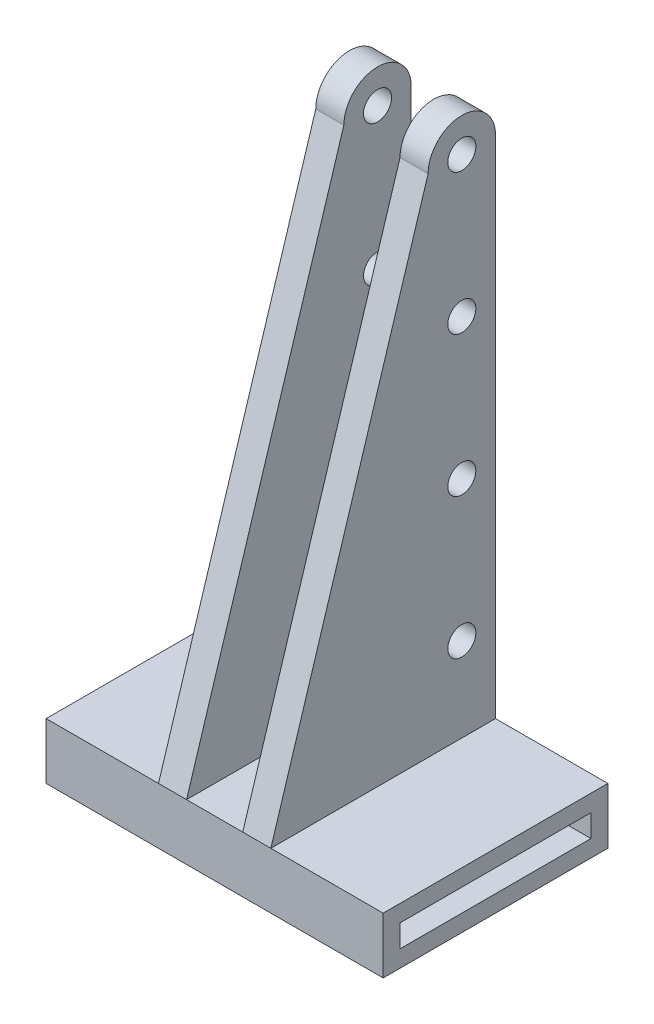
from build123d import *

# Parameters (mm, degrees)
SKETCH1_W           = 60
SKETCH1_H           = 40
BOSS_EXTRUDE1_DEPTH = 10
BOSS_EXTRUDE2_START = 5
SKETCH2_R           = 2.5
BOSS_EXTRUDE2_DEPTH = 5
BOSS_EXTRUDE3_START = -10
SKETCH2_3_R         = 2.5
BOSS_EXTRUDE3_DEPTH = 5
SKETCH3_W           = 34
SKETCH3_H           = 4
CUT_EXTRUDE1_DEPTH  = 124.434192994


with BuildPart() as part:
    # Sketch1 → Boss-Extrude1 (new body)
    with BuildSketch(Plane(origin=(0, 0, 0), x_dir=(1, 0, 0), z_dir=(0, 1, 0))):
        Rectangle(SKETCH1_W, SKETCH1_H)
    extrude(amount=BOSS_EXTRUDE1_DEPTH)

    # Sketch2 → Boss-Extrude2 (add)
    with BuildSketch(Plane(origin=(0, 0, 0), x_dir=(0, 0, -1), z_dir=(1, 0, 0)).offset(BOSS_EXTRUDE2_START)):
        with BuildLine():
            Line((-20, 10), (20, 10))
            Line((20, 10), (20, 100))
            ThreePointArc((20, 100), (14, 106), (8, 100))
            Line((8, 100), (-20, 10))
        make_face()
        with Locations((14, 25)):
            Circle(SKETCH2_R, mode=Mode.SUBTRACT)
        with Locations((14, 50)):
            Circle(SKETCH2_R, mode=Mode.SUBTRACT)
        with Locations((14, 75)):
            Circle(SKETCH2_R, mode=Mode.SUBTRACT)
        with Locations((14, 100)):
            Circle(SKETCH2_R, mode=Mode.SUBTRACT)
    extrude(amount=BOSS_EXTRUDE2_DEPTH)

    # Sketch2<3> → Boss-Extrude3 (add)
    with BuildSketch(Plane(origin=(0, 0, 0), x_dir=(0, 0, -1), z_dir=(1, 0, 0)).offset(BOSS_EXTRUDE3_START)):
        with BuildLine():
            Line((-20, 10), (20, 10))
            Line((20, 10), (20, 100))
            ThreePointArc((20, 100), (14, 106), (8, 100))
            Line((8, 100), (-20, 10))
        make_face()
        with Locations((14, 25)):
            Circle(SKETCH2_3_R, mode=Mode.SUBTRACT)
        with Locations((14, 50)):
            Circle(SKETCH2_3_R, mode=Mode.SUBTRACT)
        with Locations((14, 75)):
            Circle(SKETCH2_3_R, mode=Mode.SUBTRACT)
        with Locations((14, 100)):
            Circle(SKETCH2_3_R, mode=Mode.SUBTRACT)
    extrude(amount=BOSS_EXTRUDE3_DEPTH)

    # Sketch3 → Cut-Extrude1 (cut, through all)
    with BuildSketch(Plane.ZY.offset(30)):
        with Locations((0, 5)):
            Rectangle(SKETCH3_W, SKETCH3_H)
    extrude(amount=-CUT_EXTRUDE1_DEPTH, mode=Mode.SUBTRACT)


solid = part.part
